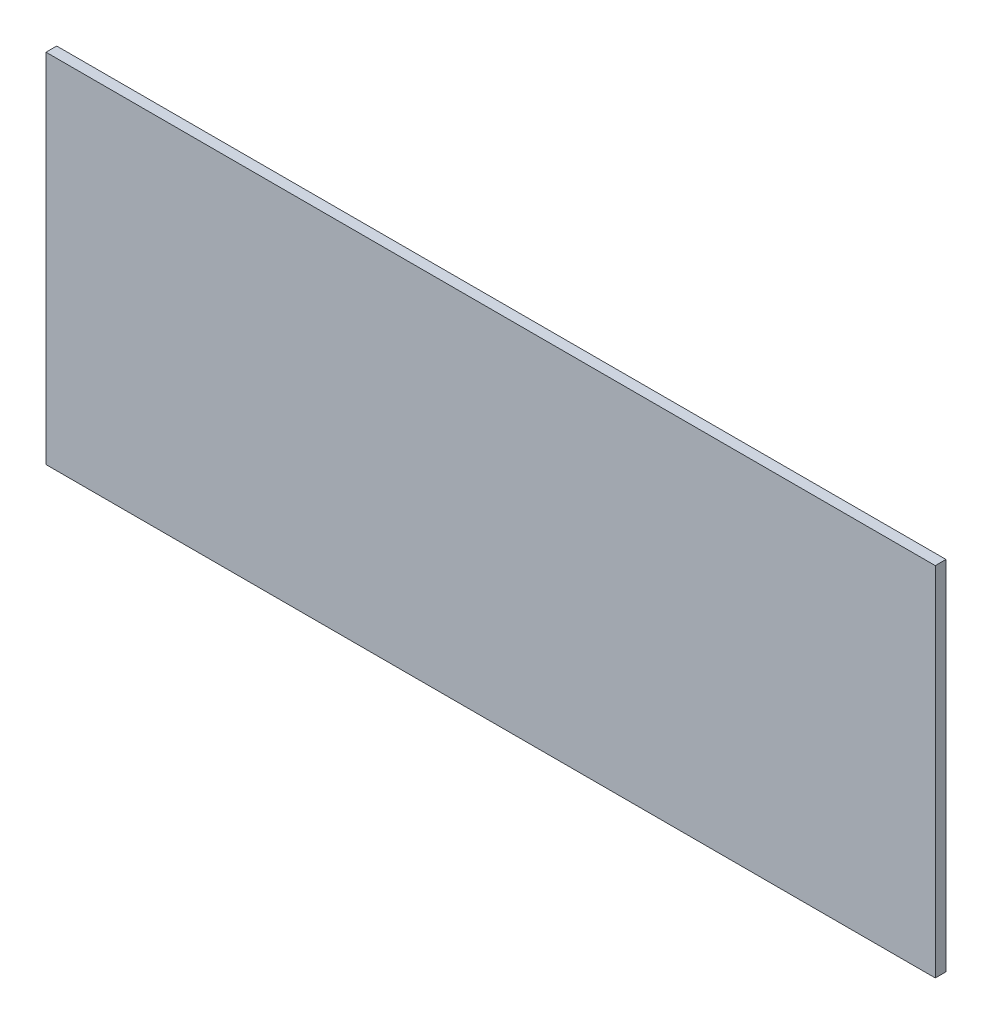
from build123d import *

# Parameters (mm, degrees)
ESBO_O1_W                = 124.5
ESBO_O1_H                = 50
RESSALTO_EXTRUS_O1_DEPTH = 1.5


with BuildPart() as part:
    # Esboço1 → Ressalto-extrusão1 (new body)
    with BuildSketch(Plane.XY):
        with Locations((62.25, 25)):
            Rectangle(ESBO_O1_W, ESBO_O1_H)
    extrude(amount=RESSALTO_EXTRUS_O1_DEPTH)


solid = part.part
